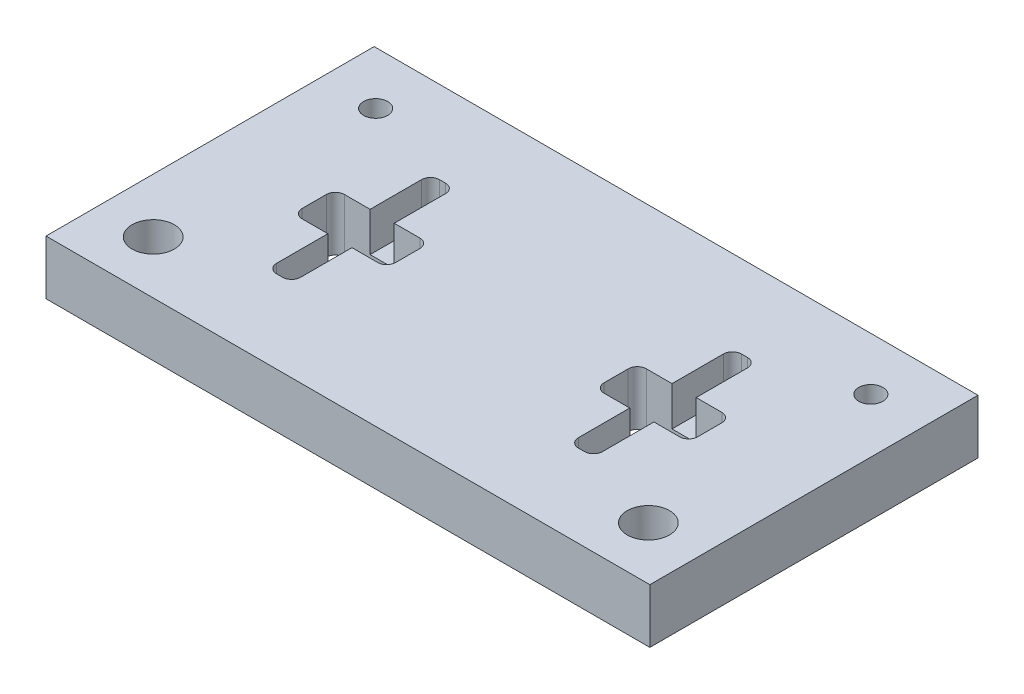
from build123d import *

# Parameters (mm, degrees)
SKETCH1_W           = 200
SKETCH1_H           = 108.68
BOSS_EXTRUDE1_DEPTH = 18
SKETCH2_R           = 4
SKETCH2_R_2         = 7
SKETCH2_W           = 31
SKETCH2_H           = 14
CUT_EXTRUDE1_DEPTH  = 30
SKETCH3_W           = 8
SKETCH3_H           = 20
CUT_EXTRUDE2_DEPTH  = 13
FILLET1_R           = 3


with BuildPart() as part:
    # Sketch1 → Boss-Extrude1 (new body)
    with BuildSketch(Plane(origin=(0, 0, 0), x_dir=(1, 0, 0), z_dir=(0, 1, 0))):
        with Locations((100, -54.34)):
            Rectangle(SKETCH1_W, SKETCH1_H)
    extrude(amount=BOSS_EXTRUDE1_DEPTH)

    # Sketch2 → Cut-Extrude1 (cut)
    with BuildSketch(Plane(origin=(0, 18, 0), x_dir=(1, 0, 0), z_dir=(0, 1, 0))):
        with Locations(Location((18, -17.5, 0), (0, 0, 270))):
            Circle(SKETCH2_R)
        with Locations(Location((182, -17.5, 0), (0, 0, 270))):
            Circle(SKETCH2_R)
        with Locations(Location((18, -91.18, 0), (0, 0, 270))):
            Circle(SKETCH2_R_2)
        with Locations(Location((182, -91.18, 0), (0, 0, 270))):
            Circle(SKETCH2_R_2)
        with Locations((150, -54.34)):
            Rectangle(SKETCH2_W, SKETCH2_H)
        with Locations((50, -54.34)):
            Rectangle(SKETCH2_W, SKETCH2_H)
    extrude(amount=-CUT_EXTRUDE1_DEPTH, mode=Mode.SUBTRACT)

    # Sketch3 → Cut-Extrude2 (cut)
    with BuildSketch(Plane(origin=(0, 18, 0), x_dir=(1, 0, 0), z_dir=(0, 1, 0))):
        with Locations((50, -37.34)):
            Rectangle(SKETCH3_W, SKETCH3_H)
        with Locations((50, -71.34)):
            Rectangle(SKETCH3_W, SKETCH3_H)
        with Locations((150, -71.34)):
            Rectangle(SKETCH3_W, SKETCH3_H)
        with Locations((150, -37.34)):
            Rectangle(SKETCH3_W, SKETCH3_H)
    extrude(amount=-CUT_EXTRUDE2_DEPTH, mode=Mode.SUBTRACT)

    # Fillet1
    fillet1_edges = [part.edges().sort_by_distance(p)[0] for p in [
        (146, 11.5, 27.34),
        (154, 11.5, 27.34),
        (34.5, 9, 61.34),
        (34.5, 9, 47.34),
        (65.5, 9, 47.34),
        (65.5, 9, 61.34),
        (134.5, 9, 47.34),
        (165.5, 9, 47.34),
        (165.5, 9, 61.34),
        (134.5, 9, 61.34),
        (46, 11.5, 27.34),
        (54, 11.5, 27.34),
        (46, 11.5, 81.34),
        (54, 11.5, 81.34),
        (154, 11.5, 81.34),
        (146, 11.5, 81.34),
    ]]
    fillet(fillet1_edges, radius=FILLET1_R)


solid = part.part
